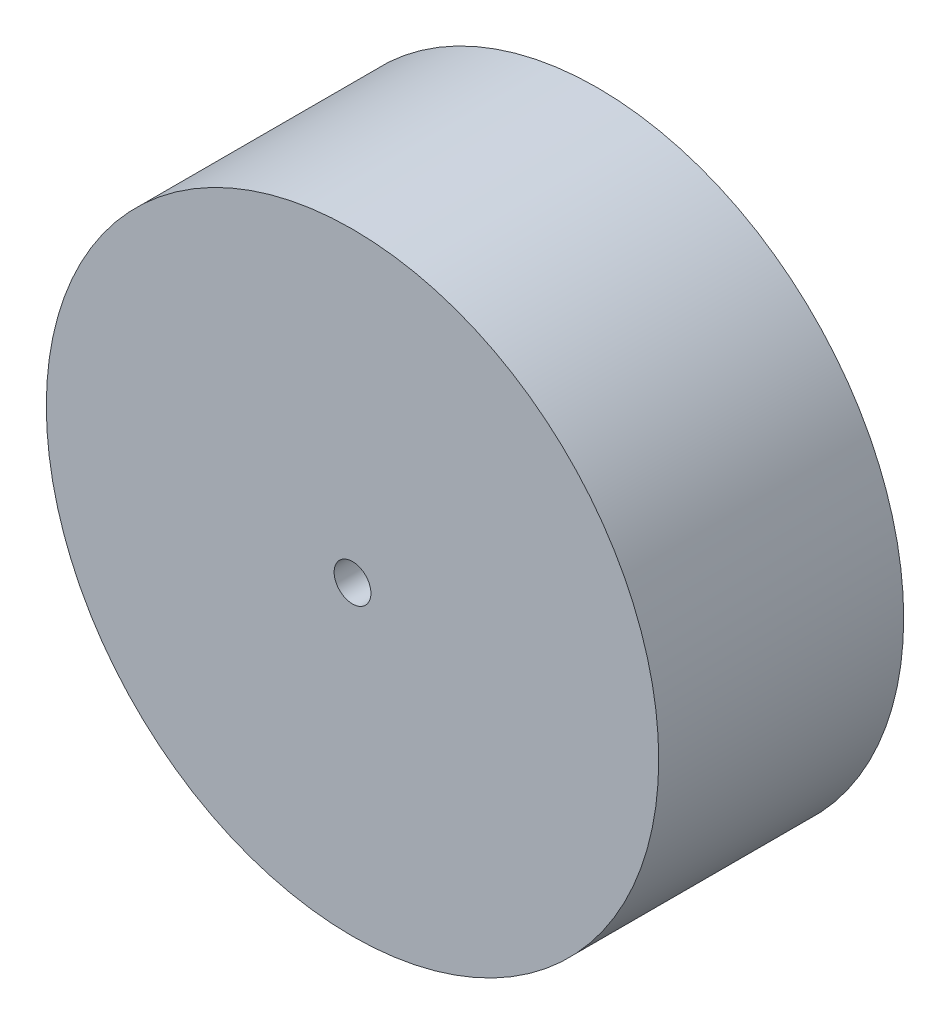
from build123d import *

# Parameters (mm, degrees)
SKETCH1_R           = 50
BOSS_EXTRUDE1_DEPTH = 40
SKETCH2_R           = 3
CUT_EXTRUDE2_DEPTH  = 50


with BuildPart() as part:
    # Sketch1 → Boss-Extrude1 (new body)
    with BuildSketch(Plane.XY):
        Circle(SKETCH1_R)
    extrude(amount=BOSS_EXTRUDE1_DEPTH)

    # Sketch2 → Cut-Extrude2 (cut)
    with BuildSketch(Plane(origin=(0, 0, 0), x_dir=(-1, 0, 0), z_dir=(0, 0, -1))):
        Circle(SKETCH2_R)
    extrude(amount=-CUT_EXTRUDE2_DEPTH, mode=Mode.SUBTRACT)


solid = part.part
